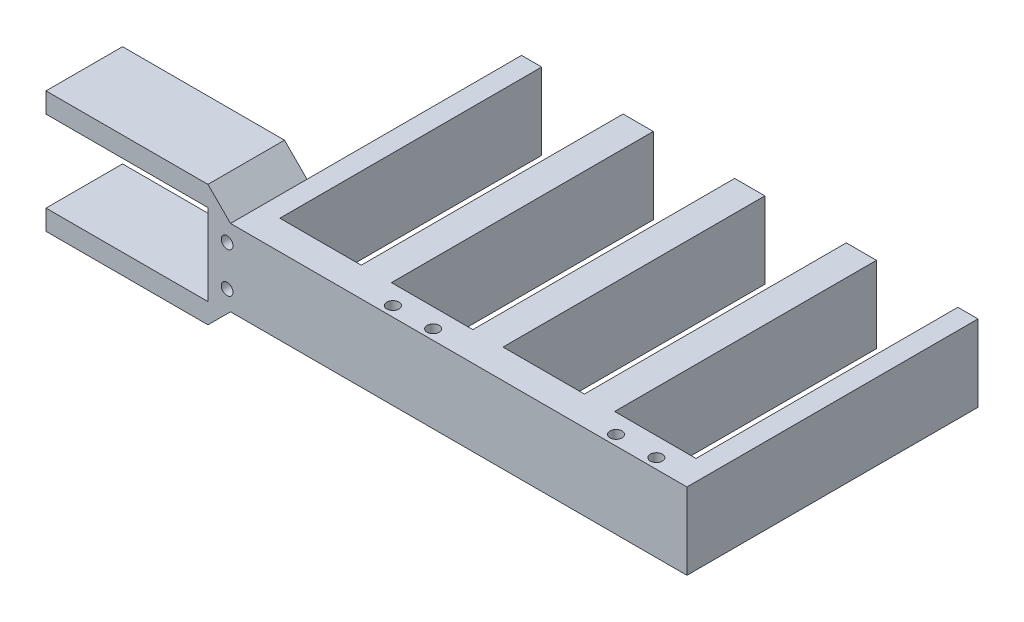
from build123d import *

# Parameters (mm, degrees)
BOSS_EXTRUDE1_DEPTH      = 9.5
BOSS_EXTRUDE1_DEPTH_BACK = 9.5
BOSS_EXTRUDE2_DEPTH      = 19
SKETCH4_R                = 1.45
CUT_EXTRUDE1_DEPTH       = 10
SKETCH5_R                = 1.5
CUT_EXTRUDE2_DEPTH       = 10
SKETCH6_R                = 1.45
CUT_EXTRUDE3_DEPTH       = 10
SKETCH7_R                = 1.45
CUT_EXTRUDE4_DEPTH       = 10


with BuildPart() as part:
    # Sketch2 → Boss-Extrude1 (new, two sides: drawn at the far end of the back side and taken through both)
    with BuildSketch(Plane(origin=(0, 0, 0), x_dir=(-1, 0, 0), z_dir=(0, 1, 0)).offset(-BOSS_EXTRUDE1_DEPTH_BACK)):
        Polygon((-23.95, 28.875), (-3.75, 28.875), (-3.75, -36.125), (3.75, -36.125), (3.75, 28.875), (23.95, 28.875), (23.95, -36.125), (31.45, -36.125), (31.45, 28.875), (51.65, 28.875), (51.65, -36.125), (56.65, -36.125), (56.65, 36.125), (-56.65, 36.125), (-56.65, -36.125), (-51.65, -36.125), (-51.65, 28.875), (-31.45, 28.875), (-31.45, -36.125), (-23.95, -36.125), align=None)
    extrude(amount=BOSS_EXTRUDE1_DEPTH + BOSS_EXTRUDE1_DEPTH_BACK)

    # Sketch3 → Boss-Extrude2 (add)
    with BuildSketch(Plane.XY.offset(36.125)):
        Polygon((-56.65, 9.5), (-62.25, 15.1), (-102.45, 15.1), (-102.45, 10.1), (-62.25, 10.1), (-62.25, -10.1), (-102.45, -10.1), (-102.45, -15.1), (-62.25, -15.1), (-56.65, -9.5), align=None)
    extrude(amount=-BOSS_EXTRUDE2_DEPTH)

    # Sketch4 → Cut-Extrude1 (cut)
    with BuildSketch(Plane.XY.offset(36.125)):
        with Locations((-57.5, 5)):
            Circle(SKETCH4_R)
        with Locations((-57.5, -5)):
            Circle(SKETCH4_R)
    extrude(amount=-CUT_EXTRUDE1_DEPTH, mode=Mode.SUBTRACT)

    # Sketch5 → Cut-Extrude2 (cut)
    with BuildSketch(Plane(origin=(0, 9.5, 0), x_dir=(-1, 0, 0), z_dir=(0, 1, 0))):
        with Locations((-46.55, 33.625)):
            Circle(SKETCH5_R)
        with Locations((-36.55, 33.625)):
            Circle(SKETCH5_R)
        with Locations((8.85, 33.625)):
            Circle(SKETCH5_R)
        with Locations((18.85, 33.625)):
            Circle(SKETCH5_R)
    extrude(amount=-CUT_EXTRUDE2_DEPTH, mode=Mode.SUBTRACT)

    # Sketch6 → Cut-Extrude3 (cut)
    with BuildSketch(Plane.XZ.offset(9.5)):
        with Locations((-46.55, 33.625)):
            Circle(SKETCH6_R)
        with Locations((-36.55, 33.625)):
            Circle(SKETCH6_R)
        with Locations((9.254566693, 33.625)):
            Circle(SKETCH6_R)
        with Locations((19.254566693, 33.625)):
            Circle(SKETCH6_R)
    extrude(amount=-CUT_EXTRUDE3_DEPTH, mode=Mode.SUBTRACT)

    # Sketch7 → Cut-Extrude4 (cut)
    with BuildSketch(Plane(origin=(0, 0, -36.125), x_dir=(1, 0, 0), z_dir=(0, 0, -1))):
        with Locations((-27.7, 0)):
            Circle(SKETCH7_R)
        with Locations((27.7, 0)):
            Circle(SKETCH7_R)
    extrude(amount=-CUT_EXTRUDE4_DEPTH, mode=Mode.SUBTRACT)


solid = part.part
